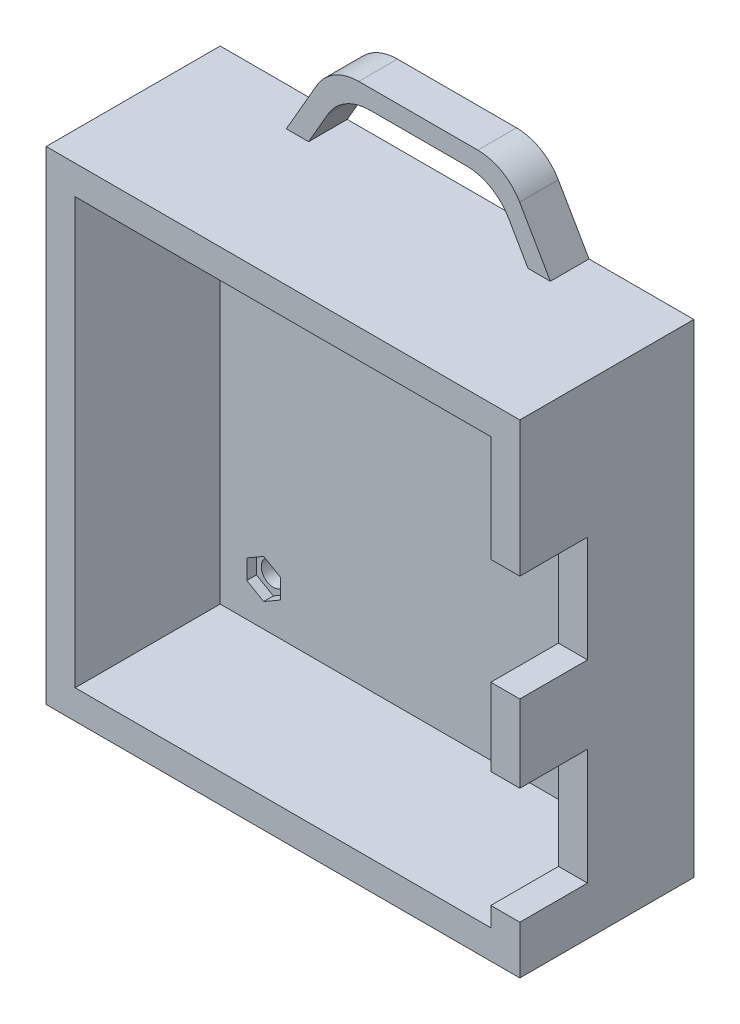
from build123d import *

# Parameters (mm, degrees)
SKETCH_1_W          = 49
SKETCH_1_H          = 50
EXTRUDE_1_DEPTH     = 10
SKETCH_3_W          = 43
SKETCH_3_H          = 44
CUT_EXTRUDE_1_DEPTH = 7
CUT_EXTRUDE_2_DEPTH = 1
SKETCH_5_R          = 1.25
CUT_EXTRUDE_3_DEPTH = 3
SKETCH_7_W          = 8
SKETCH_7_H          = 50
EXTRUDE_2_DEPTH     = 3
SKETCH_8_W          = 7
SKETCH_8_H          = 12
SKETCH_8_H_2        = 11
CUT_EXTRUDE_5_DEPTH = 3
EXTRUDE_3_DEPTH     = 8
EXTRUDE_4_DEPTH     = 4


with BuildPart() as part:
    # 草图1 → 凸台-拉伸1 (new body)
    with BuildSketch(Plane.XY):
        Rectangle(SKETCH_1_W, SKETCH_1_H)
    extrude(amount=EXTRUDE_1_DEPTH)

    # 草图3 → 切除-拉伸1 (cut)
    with BuildSketch(Plane.XY.offset(10)):
        Rectangle(SKETCH_3_W, SKETCH_3_H)
    extrude(amount=-CUT_EXTRUDE_1_DEPTH, mode=Mode.SUBTRACT)

    # 草图4 → 切除-拉伸2 (cut)
    with BuildSketch(Plane.XY.offset(3)):
        Polygon((17, 15.479274058), (18.75, 16.489637029), (18.75, 18.510362971), (17, 19.520725942), (15.25, 18.510362971), (15.25, 16.489637029), align=None)
        Polygon((-17, -19.520725942), (-15.25, -18.510362971), (-15.25, -16.489637029), (-17, -15.479274058), (-18.75, -16.489637029), (-18.75, -18.510362971), align=None)
    extrude(amount=-CUT_EXTRUDE_2_DEPTH, mode=Mode.SUBTRACT)

    # 草图5 → 切除-拉伸3 (cut)
    with BuildSketch(Plane.XY.offset(2)):
        with Locations((-17, -17.5)):
            Circle(SKETCH_5_R)
        with Locations((17, 17.5)):
            Circle(SKETCH_5_R)
    extrude(amount=-CUT_EXTRUDE_3_DEPTH, mode=Mode.SUBTRACT)

    # 草图7 → 凸台-拉伸2 (add)
    with BuildSketch(Plane(origin=(24.5, 0, 0), x_dir=(0, 0, -1), z_dir=(1, 0, 0))):
        with Locations((-14, 0)):
            Rectangle(SKETCH_7_W, SKETCH_7_H)
    extrude(amount=-EXTRUDE_2_DEPTH)

    # 草图8 → 切除-拉伸5 (cut)
    with BuildSketch(Plane(origin=(24.5, 0, 0), x_dir=(0, 0, -1), z_dir=(1, 0, 0))):
        with Locations((-14.5, -14)):
            Rectangle(SKETCH_8_W, SKETCH_8_H)
        with Locations((-14.5, 5.5)):
            Rectangle(SKETCH_8_W, SKETCH_8_H_2)
    extrude(amount=-CUT_EXTRUDE_5_DEPTH, mode=Mode.SUBTRACT)

    # 草图9 → 凸台-拉伸3 (add)
    with BuildSketch(Plane.XY.offset(10)):
        Polygon((-24.5, -25), (21.5, -25), (21.5, -22), (-21.5, -22), (-21.5, 22), (21.5, 22), (21.5, 25), (-24.5, 25), align=None)
    extrude(amount=EXTRUDE_3_DEPTH)

    # 草图11 → 凸台-拉伸4 (add)
    with BuildSketch(Plane(origin=(0, 0, 0), x_dir=(-1, 0, 0), z_dir=(0, 0, -1))):
        with BuildLine():
            Line((-13.660254038, -25), (-11.350852961, -25))
            Line((-11.350852961, -25), (-9.330127019, -28.5))
            ThreePointArc((-9.330127019, -28.5), (-7.5, -30.330127019), (-5, -31))
            Line((-5, -31), (5, -31))
            ThreePointArc((5, -31), (7.5, -30.330127019), (9.330127019, -28.5))
            Line((9.330127019, -28.5), (11.350852961, -25))
            Line((11.350852961, -25), (13.660254038, -25))
            Line((13.660254038, -25), (13.082903769, -26))
            Line((13.082903769, -26), (10.484827557, -30.5))
            ThreePointArc((10.484827557, -30.5), (8.654700538, -32.330127019), (6.154700538, -33))
            Line((6.154700538, -33), (-6.154700538, -33))
            ThreePointArc((-6.154700538, -33), (-8.654700538, -32.330127019), (-10.484827557, -30.5))
            Line((-10.484827557, -30.5), (-13.082903769, -26))
            Line((-13.082903769, -26), (-13.660254038, -25))
        make_face()
    extrude_4 = extrude(amount=-EXTRUDE_4_DEPTH)

    # 镜向1: 凸台-拉伸4 across plane
    add(extrude_4.mirror(Plane.ZX))


solid = part.part
